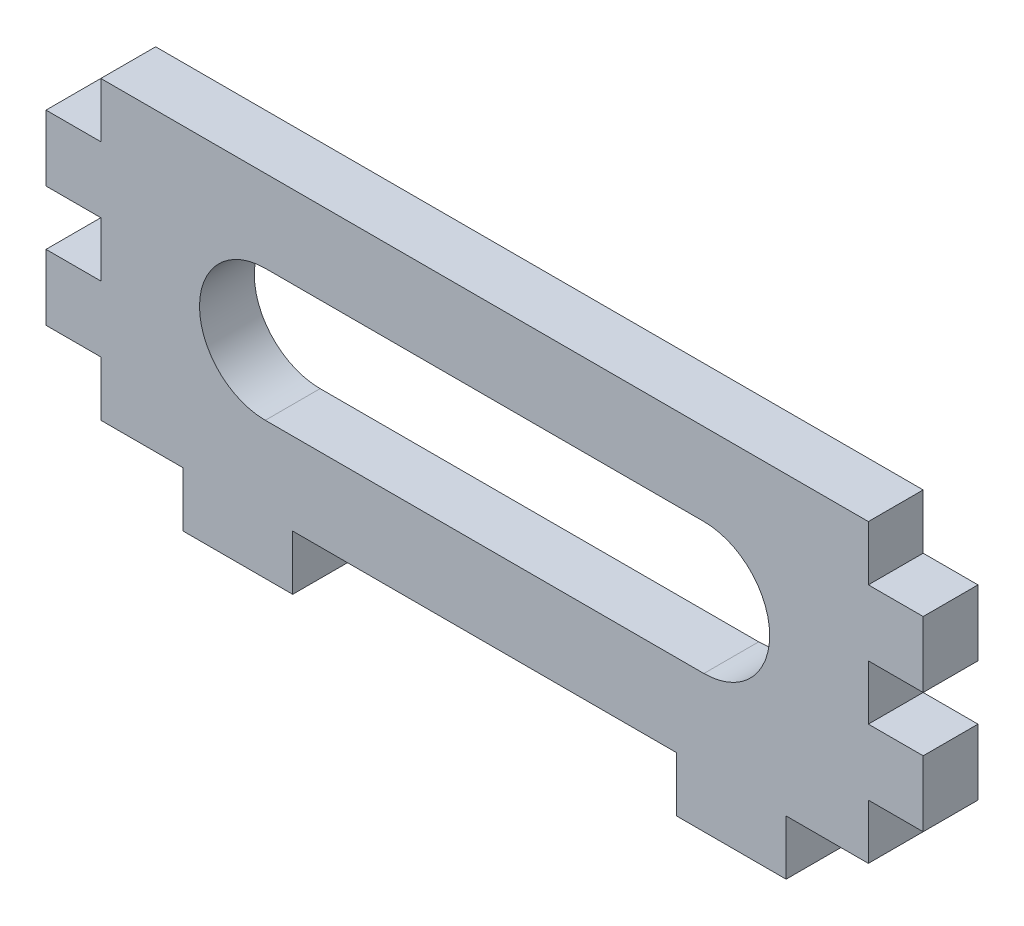
from build123d import *

# Parameters (mm, degrees)
ESQUISSE1_W        = 80
ESQUISSE1_H        = 27
BOSS_EXTRU_1_DEPTH = 5
ESQUISSE2_W        = 5
ESQUISSE2_H        = 5
CR_NEAUX_DEPTH     = 5
ESQUISSE3_W        = 10
ESQUISSE3_H        = 5
BOSS_EXTRU_2_DEPTH = 5


with BuildPart() as part:
    # Esquisse1 → Boss.-Extru.1 (new body)
    with BuildSketch(Plane.XY):
        with Locations((-161.17461402, 156.921111622)):
            Rectangle(ESQUISSE1_W, ESQUISSE1_H)
    extrude(amount=-BOSS_EXTRU_1_DEPTH)

    # Esquisse2 → Créneaux - (cut)
    with BuildSketch(Plane.XY):
        with Locations((-123.67461402, 167.921111622)):
            Rectangle(ESQUISSE2_W, ESQUISSE2_H)
        with Locations((-123.67461402, 145.921111622)):
            Rectangle(ESQUISSE2_W, ESQUISSE2_H)
        with Locations((-123.67461402, 156.921111622)):
            Rectangle(ESQUISSE2_W, ESQUISSE2_H)
        with Locations((-198.67461402, 156.921111622)):
            Rectangle(ESQUISSE2_W, ESQUISSE2_H)
        with Locations((-198.67461402, 145.921111622)):
            Rectangle(ESQUISSE2_W, ESQUISSE2_H)
        with Locations((-198.67461402, 167.921111622)):
            Rectangle(ESQUISSE2_W, ESQUISSE2_H)
        with BuildLine():
            Line((-181.17461402, 162.921111622), (-141.17461402, 162.921111622))
            ThreePointArc((-141.17461402, 162.921111622), (-135.17461402, 156.921111622), (-141.17461402, 150.921111622))
            Line((-141.17461402, 150.921111622), (-181.17461402, 150.921111622))
            ThreePointArc((-181.17461402, 150.921111622), (-187.17461402, 156.921111622), (-181.17461402, 162.921111622))
        make_face()
    extrude(amount=-CR_NEAUX_DEPTH, mode=Mode.SUBTRACT)

    # Esquisse3 → Boss.-Extru.2 (add)
    with BuildSketch(Plane.XY):
        with Locations((-183.67461402, 140.921111622)):
            Rectangle(ESQUISSE3_W, ESQUISSE3_H)
        with Locations((-138.67461402, 140.921111622)):
            Rectangle(ESQUISSE3_W, ESQUISSE3_H)
    extrude(amount=-BOSS_EXTRU_2_DEPTH)


solid = part.part
